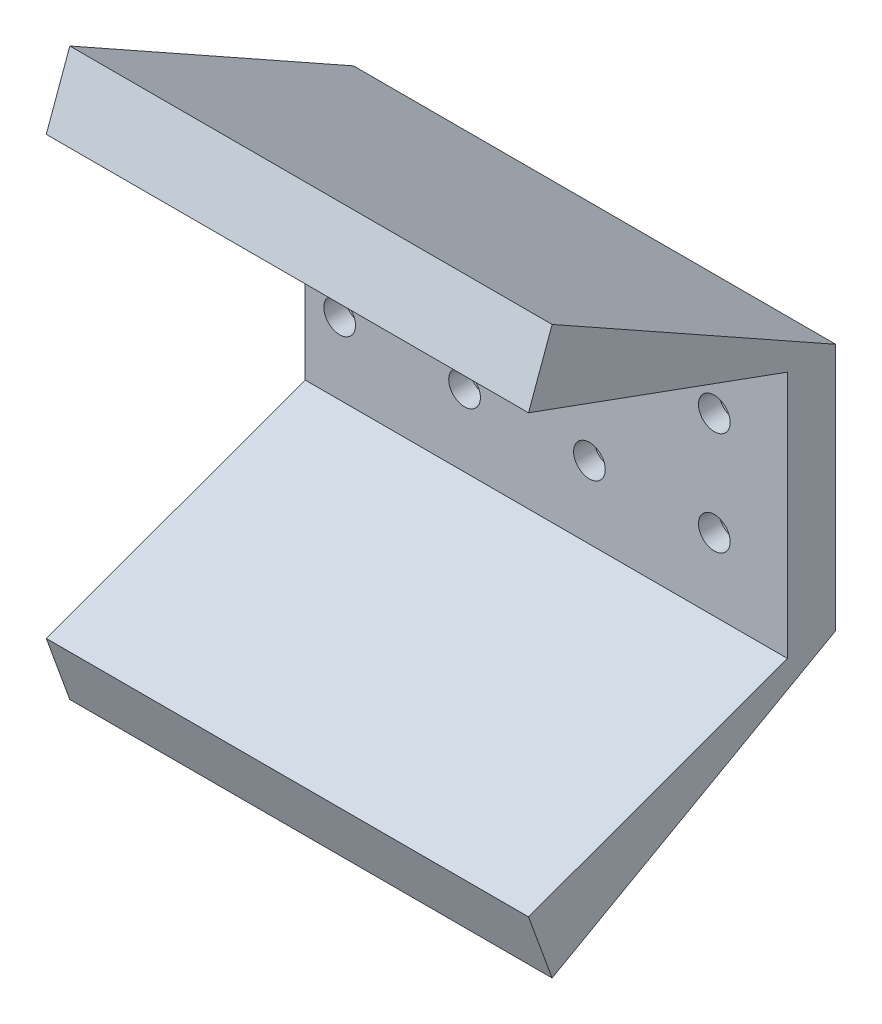
from build123d import *

# Parameters (mm, degrees)
ESQUISSE1_W             = 70
ESQUISSE1_H             = 36
ESQUISSE1_R             = 2.3
BOSS_EXTRU_1_DEPTH      = 7
ESQUISSE2_R             = 4
ENL_V_MAT_EXTRU_1_DEPTH = 4
BOSS_EXTRU_2_DEPTH      = 70


with BuildPart() as part:
    # Esquisse1 → Boss.-Extru.1 (new body)
    with BuildSketch(Plane.XY):
        with Locations((35, 18)):
            Rectangle(ESQUISSE1_W, ESQUISSE1_H)
        with Locations((5, 25.5)):
            Circle(ESQUISSE1_R, mode=Mode.SUBTRACT)
        with Locations((5, 10.5)):
            Circle(ESQUISSE1_R, mode=Mode.SUBTRACT)
        with Locations((23.125, 25.5)):
            Circle(ESQUISSE1_R, mode=Mode.SUBTRACT)
        with Locations((23.125, 10.5)):
            Circle(ESQUISSE1_R, mode=Mode.SUBTRACT)
        with Locations((41.25, 25.5)):
            Circle(ESQUISSE1_R, mode=Mode.SUBTRACT)
        with Locations((41.25, 10.5)):
            Circle(ESQUISSE1_R, mode=Mode.SUBTRACT)
        with Locations((59.375, 25.5)):
            Circle(ESQUISSE1_R, mode=Mode.SUBTRACT)
        with Locations((59.375, 10.5)):
            Circle(ESQUISSE1_R, mode=Mode.SUBTRACT)
    extrude(amount=BOSS_EXTRU_1_DEPTH)

    # Esquisse2 → Enlèv. mat.-Extru.1 (cut)
    with BuildSketch(Plane(origin=(0, 0, 0), x_dir=(-1, 0, 0), z_dir=(0, 0, -1))):
        with Locations((-59.375, 25.5)):
            Circle(ESQUISSE2_R)
        with Locations((-41.25, 25.5)):
            Circle(ESQUISSE2_R)
        with Locations((-23.125, 25.5)):
            Circle(ESQUISSE2_R)
        with Locations((-5, 25.5)):
            Circle(ESQUISSE2_R)
        with Locations((-5, 10.5)):
            Circle(ESQUISSE2_R)
        with Locations((-23.125, 10.5)):
            Circle(ESQUISSE2_R)
        with Locations((-41.25, 10.5)):
            Circle(ESQUISSE2_R)
        with Locations((-59.375, 10.5)):
            Circle(ESQUISSE2_R)
    extrude(amount=-ENL_V_MAT_EXTRU_1_DEPTH, mode=Mode.SUBTRACT)

    # Esquisse3 → Boss.-Extru.2 (add)
    with BuildSketch(Plane(origin=(70, 0, 0), x_dir=(0, 0, -1), z_dir=(1, 0, 0))):
        Polygon((-41.167503398, 59.077731941), (0, 36), (-7, 36), (-44.587704831, 49.680805733), align=None)
        Polygon((-44.587704831, -13.680805733), (-41.167503398, -23.077731941), (0, 0), (-7, 0), align=None)
    extrude(amount=-BOSS_EXTRU_2_DEPTH)


solid = part.part
